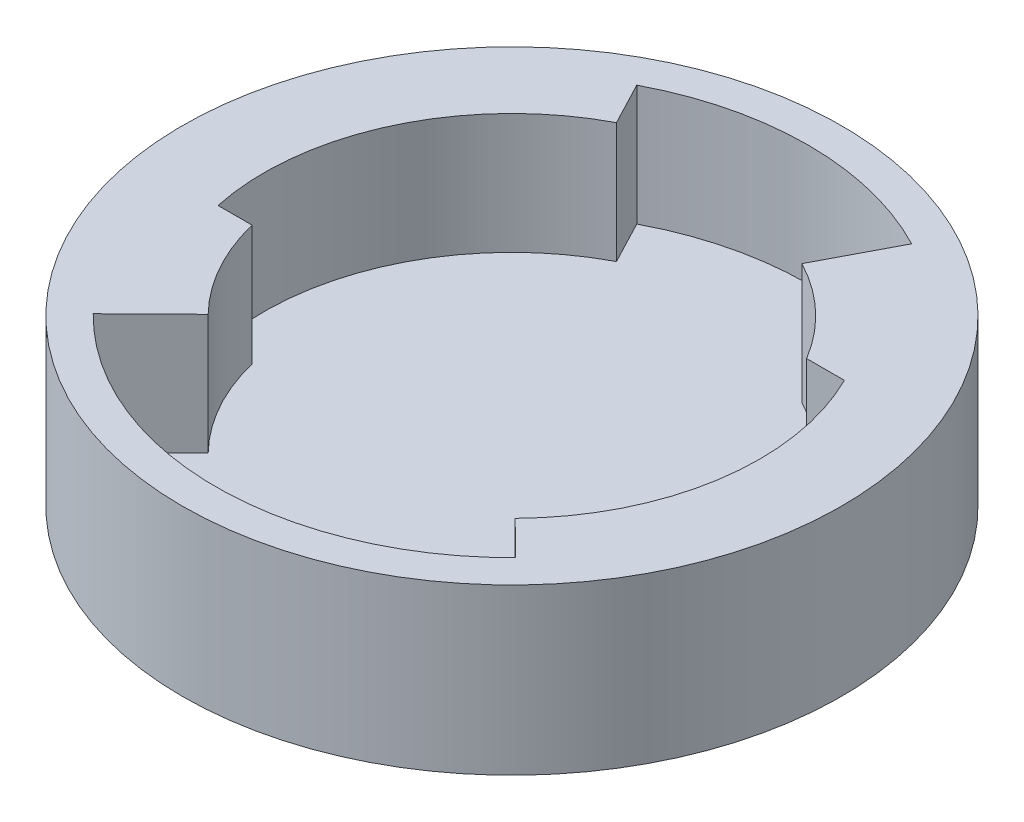
from build123d import *

# Parameters (mm, degrees)
SKETCH1_R           = 50
BOSS_EXTRUDE1_DEPTH = 25
CUT_EXTRUDE1_DEPTH  = 18.25


with BuildPart() as part:
    # Sketch1 → Boss-Extrude1 (new body)
    with BuildSketch(Plane(origin=(0, 0, 0), x_dir=(1, 0, 0), z_dir=(0, 1, 0))):
        with Locations(Location((0, 0, 0), (0, 0, 270))):
            Circle(SKETCH1_R)
    extrude(amount=-BOSS_EXTRUDE1_DEPTH)

    # Sketch2 → Cut-Extrude1 (cut)
    with BuildSketch(Plane(origin=(0, 0, 0), x_dir=(1, 0, 0), z_dir=(0, 1, 0))):
        with BuildLine():
            Line((-20.85, 39.78798688), (-17.461642921, 33.321996136))
            ThreePointArc((-17.461642921, 33.321996136), (-34.039720295, 16.017547946), (-36.805386336, -7.786394331))
            Line((-36.805386336, -7.786394331), (-31.645347938, -7.786394331))
            ThreePointArc((-31.645347938, -7.786394331), (-28.461211468, -15.874993686), (-23.252089779, -22.834103961))
            Line((-23.252089779, -22.834103961), (-32.05, -31.473860583))
            ThreePointArc((-32.05, -31.473860583), (0, -44.92), (32.05, -31.473860583))
            Line((32.05, -31.473860583), (26.841518255, -26.359007906))
            ThreePointArc((26.841518255, -26.359007906), (37.154813328, -5.897817101), (33.684688853, 16.751302542))
            Line((33.684688853, 16.751302542), (27.954424443, 16.751302542))
            ThreePointArc((27.954424443, 16.751302542), (25.023160627, 20.878156409), (21.488186441, 24.501302542))
            ThreePointArc((21.488186441, 24.501302542), (18.436983495, 26.872544025), (15.126554505, 28.865954542))
            Line((15.126554505, 28.865954542), (20.85, 39.78798688))
            ThreePointArc((20.85, 39.78798688), (0, 44.92), (-20.85, 39.78798688))
        make_face()
    extrude(amount=-CUT_EXTRUDE1_DEPTH, mode=Mode.SUBTRACT)


solid = part.part
